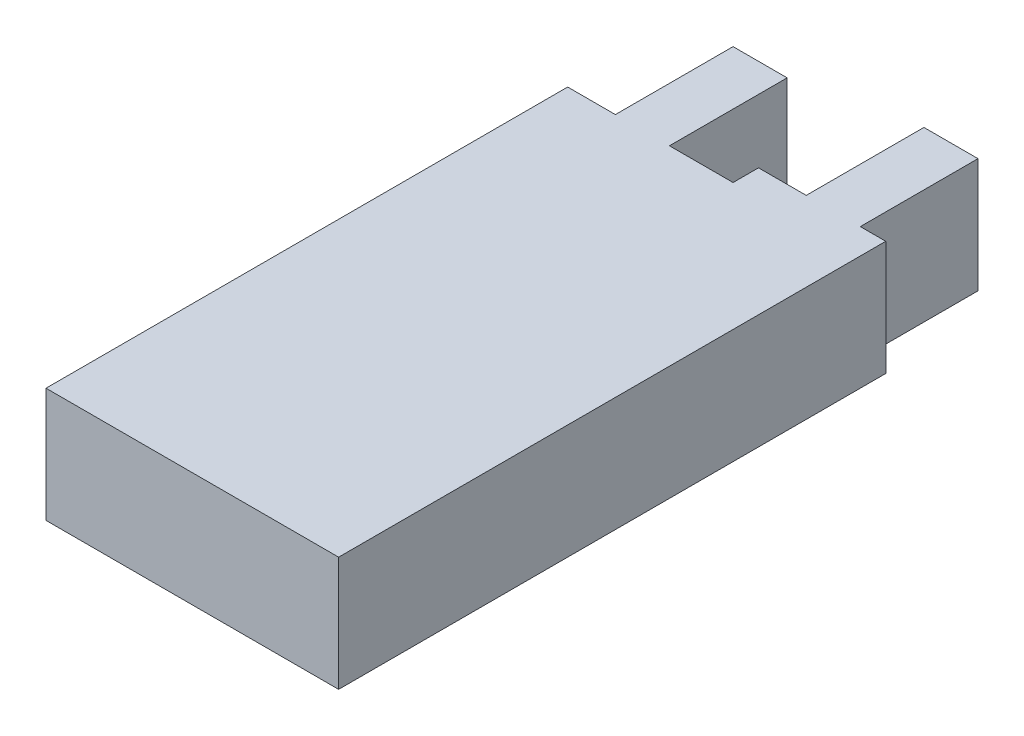
from build123d import *

# Parameters (mm, degrees)
BOSS_EXTRUDE1_DEPTH = 18


with BuildPart() as part:
    # Sketch1 → Boss-Extrude1 (new body)
    with BuildSketch(Plane(origin=(0, 0, 0), x_dir=(1, 0, 0), z_dir=(0, 1, 0))):
        Polygon((-23, 41), (-23, -41), (23, -41), (23, 45), (19, 45), (19, 63.5), (10.5, 63.5), (10.5, 45), (3, 45), (3, 41), (-7, 41), (-7, 59.5), (-15.5, 59.5), (-15.5, 41), align=None)
    extrude(amount=BOSS_EXTRUDE1_DEPTH)


solid = part.part
